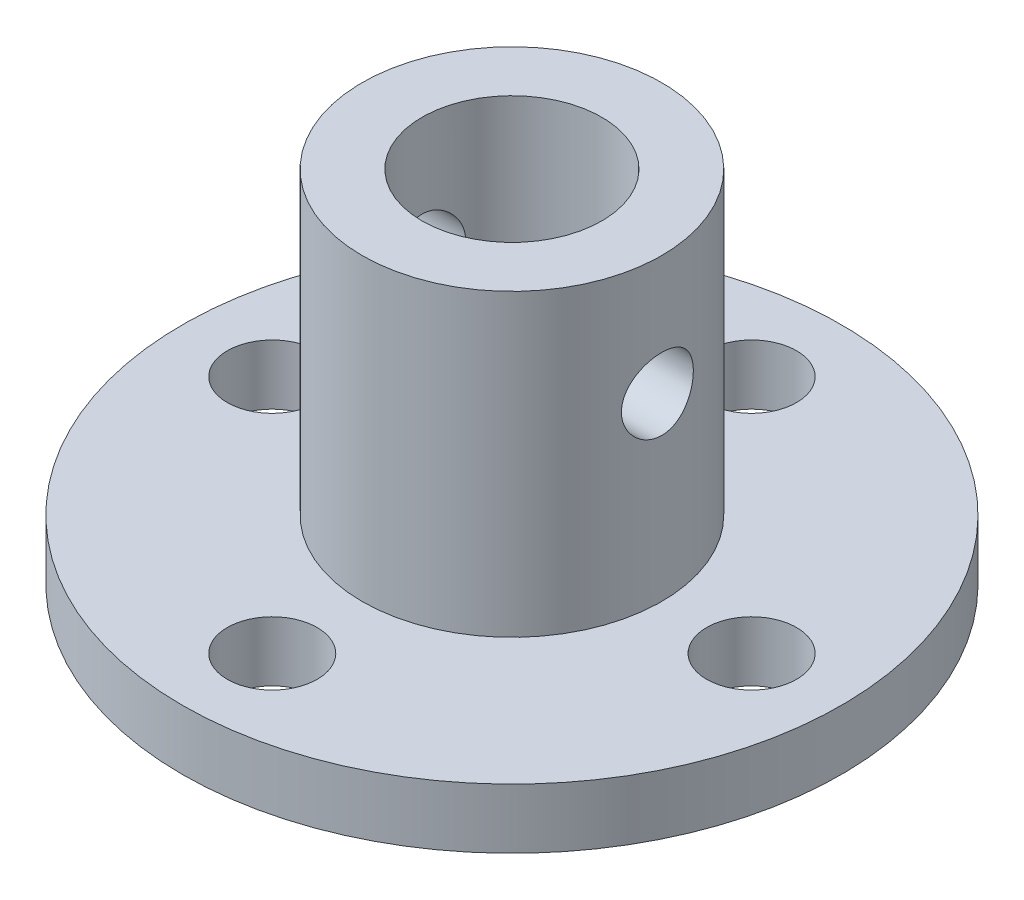
from build123d import *

# Parameters (mm, degrees)
SKETCH_1_R               = 11
EXTRUDE_1_DEPTH          = 2
SKETCH_2_R               = 5
EXTRUDE_2_DEPTH          = 10
SKETCH_3_R               = 3
CUT_EXTRUDE_1_DEPTH      = 20.646882704
SKETCH_4_R               = 1.5
CUT_EXTRUDE_2_DEPTH      = 10
CUT_EXTRUDE_3_DEPTH      = 20.646882704
CUT_EXTRUDE_3_DEPTH_BACK = 20.646882704
SKETCH_5_R               = 1.2


with BuildPart() as part:
    # 草图1 → 凸台-拉伸1 (new body)
    with BuildSketch(Plane(origin=(0, 0, 0), x_dir=(1, 0, 0), z_dir=(0, 1, 0))):
        with Locations(Location((0, 0, 0), (0, 0, 270))):
            Circle(SKETCH_1_R)
    extrude(amount=EXTRUDE_1_DEPTH)

    # 草图2 → 凸台-拉伸2 (add)
    with BuildSketch(Plane(origin=(0, 2, 0), x_dir=(1, 0, 0), z_dir=(0, 1, 0))):
        with Locations(Location((0, 0, 0), (0, 0, 270))):
            Circle(SKETCH_2_R)
    extrude(amount=EXTRUDE_2_DEPTH)

    # 草图3 → 切除-拉伸1 (cut, through all)
    with BuildSketch(Plane(origin=(0, 12, 0), x_dir=(1, 0, 0), z_dir=(0, 1, 0))):
        with Locations(Location((0, 0, 0), (0, 0, 270))):
            Circle(SKETCH_3_R)
    extrude(amount=-CUT_EXTRUDE_1_DEPTH, mode=Mode.SUBTRACT)

    # 草图4 → 切除-拉伸2 (cut)
    with BuildSketch(Plane(origin=(0, 2, 0), x_dir=(1, 0, 0), z_dir=(0, 1, 0))):
        with Locations(Location((0, 8, 0), (0, 0, 270))):
            Circle(SKETCH_4_R)
        with Locations(Location((8, 0, 0), (0, 0, 270))):
            Circle(SKETCH_4_R)
        with Locations(Location((0, -8, 0), (0, 0, 270))):
            Circle(SKETCH_4_R)
        with Locations(Location((-8, 0, 0), (0, 0, 270))):
            Circle(SKETCH_4_R)
    extrude(amount=-CUT_EXTRUDE_2_DEPTH, mode=Mode.SUBTRACT)

    # 草图5 → 切除-拉伸3 (cut, two sides: drawn at the far end of the back side and taken through both)
    with BuildSketch(Plane(origin=(0, 0, 0), x_dir=(0, 0, -1), z_dir=(1, 0, 0)).offset(-CUT_EXTRUDE_3_DEPTH_BACK)):
        with Locations((0, 8)):
            Circle(SKETCH_5_R)
    extrude(amount=CUT_EXTRUDE_3_DEPTH + CUT_EXTRUDE_3_DEPTH_BACK, mode=Mode.SUBTRACT)


solid = part.part
